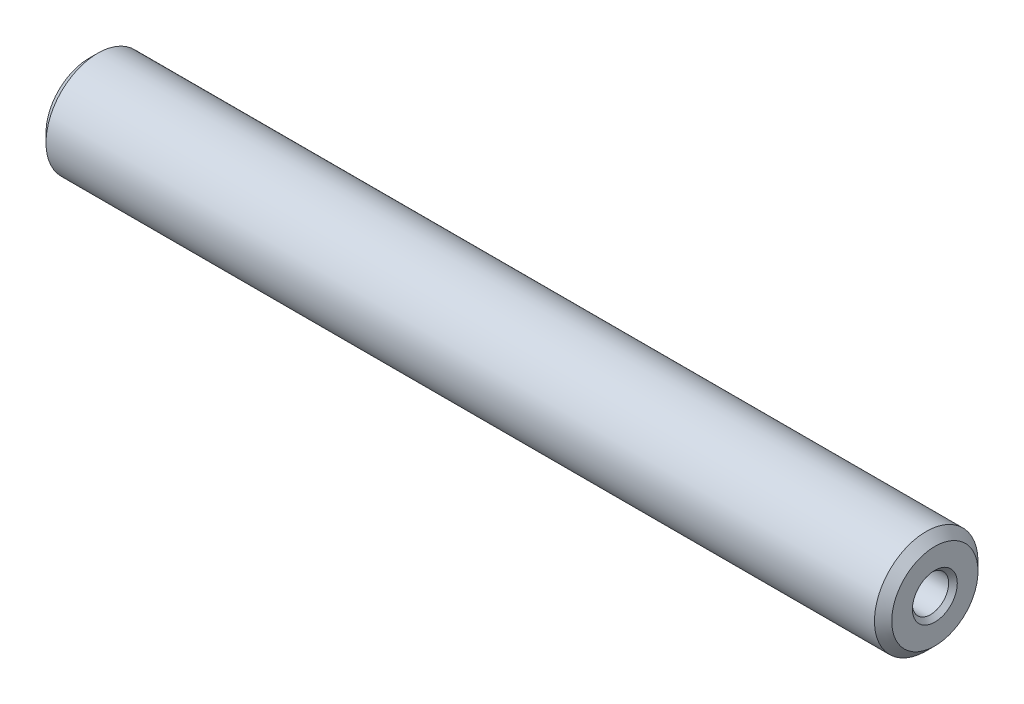
from build123d import *

# Parameters (mm, degrees)
SKETCH1_R             = 6
BOSS_EXTRUDE1_DEPTH   = 98
CHAMFER1_SIZE         = 1
M5_TAPPED_HOLE1_D     = 4.2
M5_TAPPED_HOLE1_DEPTH = 14
M5_TAPPED_HOLE1_TIP   = 1.2618073
CHAMFER2_SIZE         = 0.5
M5_TAPPED_HOLE2_D     = 4.2
M5_TAPPED_HOLE2_DEPTH = 14
M5_TAPPED_HOLE2_TIP   = 1.2618073
CHAMFER3_SIZE         = 0.5


with BuildPart() as part:
    # Sketch1 → Boss-Extrude1 (new body)
    with BuildSketch(Plane(origin=(0, 0, 0), x_dir=(0, 0, -1), z_dir=(1, 0, 0))):
        Circle(SKETCH1_R)
    extrude(amount=BOSS_EXTRUDE1_DEPTH)

    # Chamfer1
    chamfer1_edges = [part.edges().sort_by_distance(p)[0] for p in [
        (0, 0, 6),
        (98, 0, 6),
    ]]
    chamfer(chamfer1_edges, length=CHAMFER1_SIZE)

    # M5 Tapped Hole1
    with Locations(Plane(origin=(98, 0, 0), x_dir=(0, 0, -1), z_dir=(1, 0, 0))):
        with Locations((0, 0)):
            Hole(M5_TAPPED_HOLE1_D / 2, depth=M5_TAPPED_HOLE1_DEPTH)
            with Locations((0, 0, -(M5_TAPPED_HOLE1_DEPTH + M5_TAPPED_HOLE1_TIP / 2))):  # 118° drill point
                Cone(0, M5_TAPPED_HOLE1_D / 2, M5_TAPPED_HOLE1_TIP, mode=Mode.SUBTRACT)

    # Chamfer2
    chamfer2_edges = [part.edges().sort_by_distance(p)[0] for p in [
        (98, 0, -2.1),
    ]]
    chamfer(chamfer2_edges, length=CHAMFER2_SIZE)

    # M5 Tapped Hole2
    with Locations(Plane.ZY):
        with Locations((0, 0)):
            Hole(M5_TAPPED_HOLE2_D / 2, depth=M5_TAPPED_HOLE2_DEPTH)
            with Locations((0, 0, -(M5_TAPPED_HOLE2_DEPTH + M5_TAPPED_HOLE2_TIP / 2))):  # 118° drill point
                Cone(0, M5_TAPPED_HOLE2_D / 2, M5_TAPPED_HOLE2_TIP, mode=Mode.SUBTRACT)

    # Chamfer3
    chamfer3_edges = [part.edges().sort_by_distance(p)[0] for p in [
        (0, 0, 2.1),
    ]]
    chamfer(chamfer3_edges, length=CHAMFER3_SIZE)


solid = part.part
